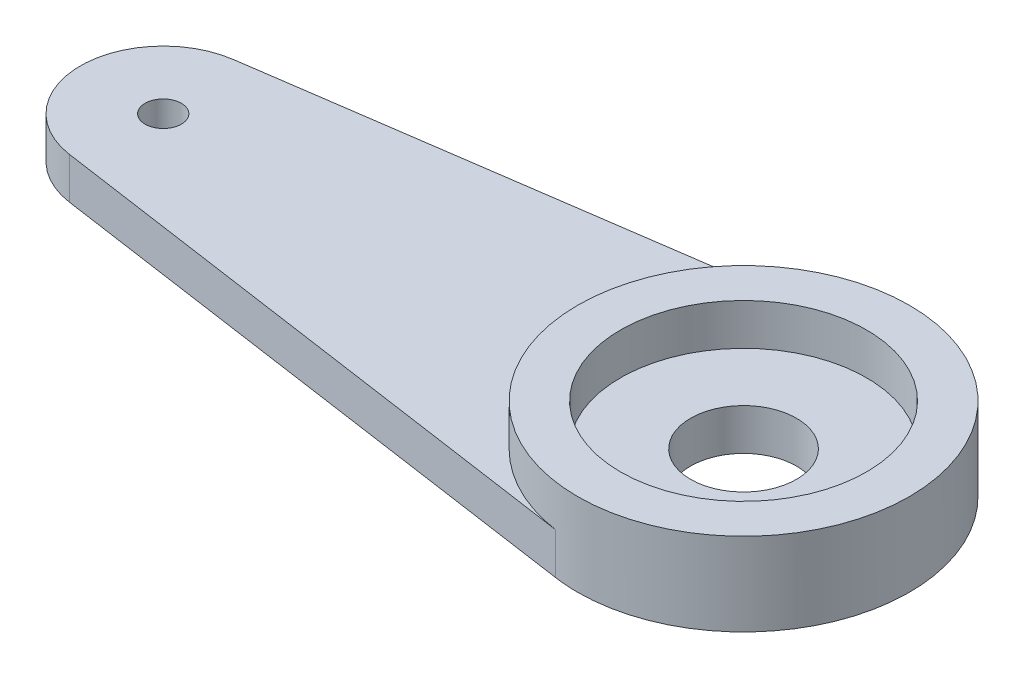
from build123d import *
from build123d.topology import SkipClean

# Parameters (mm, degrees)
EXTRUDE1_DEPTH                      = 6.35
EXTRUDE2_START                      = 6.35
SKETCH2_R                           = 25.4
EXTRUDE2_DEPTH                      = 6.35
F_7_32_0_21875_DIAMETER_HOLE1_D     = 5.55625
F_7_32_0_21875_DIAMETER_HOLE1_DEPTH = 25.4
F_7_32_0_21875_DIAMETER_HOLE1_TIP   = 1.669265907
SKETCH5_R                           = 18.848677946
EXTRUDE3_DEPTH                      = 6.35
SKETCH6_R                           = 8.113502116
EXTRUDE5_DEPTH                      = 118.260276735


with BuildPart() as part:
    # Sketch1 → Extrude1 (new body)
    with BuildSketch(Plane(origin=(0, 0, 0), x_dir=(1, 0, 0), z_dir=(0, 1, 0))):
        with BuildLine():
            Line((-1.814285714, 12.569740146), (85.271428571, 25.139480293))
            ThreePointArc((85.271428571, 25.139480293), (114.3, 0), (85.271428571, -25.139480293))
            Line((85.271428571, -25.139480293), (-1.814285714, -12.569740146))
            ThreePointArc((-1.814285714, -12.569740146), (-12.7, 0), (-1.814285714, 12.569740146))
        make_face()
    extrude(amount=-EXTRUDE1_DEPTH)

    # Sketch2 → Extrude2 (add)
    with SkipClean():  # the faces are left unmerged after this step: merging them gives an invalid solid
        with BuildSketch(Plane(origin=(0, 0, 0), x_dir=(1, 0, 0), z_dir=(0, 1, 0)).offset(EXTRUDE2_START)):
            with Locations(Location((88.9, 0, 0), (0, 0, 270))):
                Circle(SKETCH2_R)
        extrude(amount=-EXTRUDE2_DEPTH)

    # 7/32 (0.21875) Diameter Hole1
    with Locations(Plane.ZX):
        with Locations((0, 0)):
            Hole(F_7_32_0_21875_DIAMETER_HOLE1_D / 2, depth=F_7_32_0_21875_DIAMETER_HOLE1_DEPTH)
            with Locations((0, 0, -(F_7_32_0_21875_DIAMETER_HOLE1_DEPTH + F_7_32_0_21875_DIAMETER_HOLE1_TIP / 2))):  # 118° drill point
                Cone(0, F_7_32_0_21875_DIAMETER_HOLE1_D / 2, F_7_32_0_21875_DIAMETER_HOLE1_TIP, mode=Mode.SUBTRACT)

    # Sketch5 → Extrude3 (cut)
    with SkipClean():  # the faces are left unmerged after this step: merging them gives an invalid solid
        with BuildSketch(Plane(origin=(0, 6.35, 0), x_dir=(-1, 0, 0), z_dir=(0, 1, 0))):
            with Locations(Location((-88.9, 0, 0), (0, 0, 90))):
                Circle(SKETCH5_R)
        extrude(amount=-EXTRUDE3_DEPTH, mode=Mode.SUBTRACT)

    # Sketch6 → Extrude5 (cut, through all)
    with SkipClean():  # the faces are left unmerged after this step: merging them gives an invalid solid
        with BuildSketch(Plane(origin=(0, 0, 0), x_dir=(-1, 0, 0), z_dir=(0, 1, 0))):
            with Locations(Location((-88.9, 0, 0), (0, 0, 90))):
                Circle(SKETCH6_R)
        extrude(amount=-EXTRUDE5_DEPTH, mode=Mode.SUBTRACT)


solid = part.part
